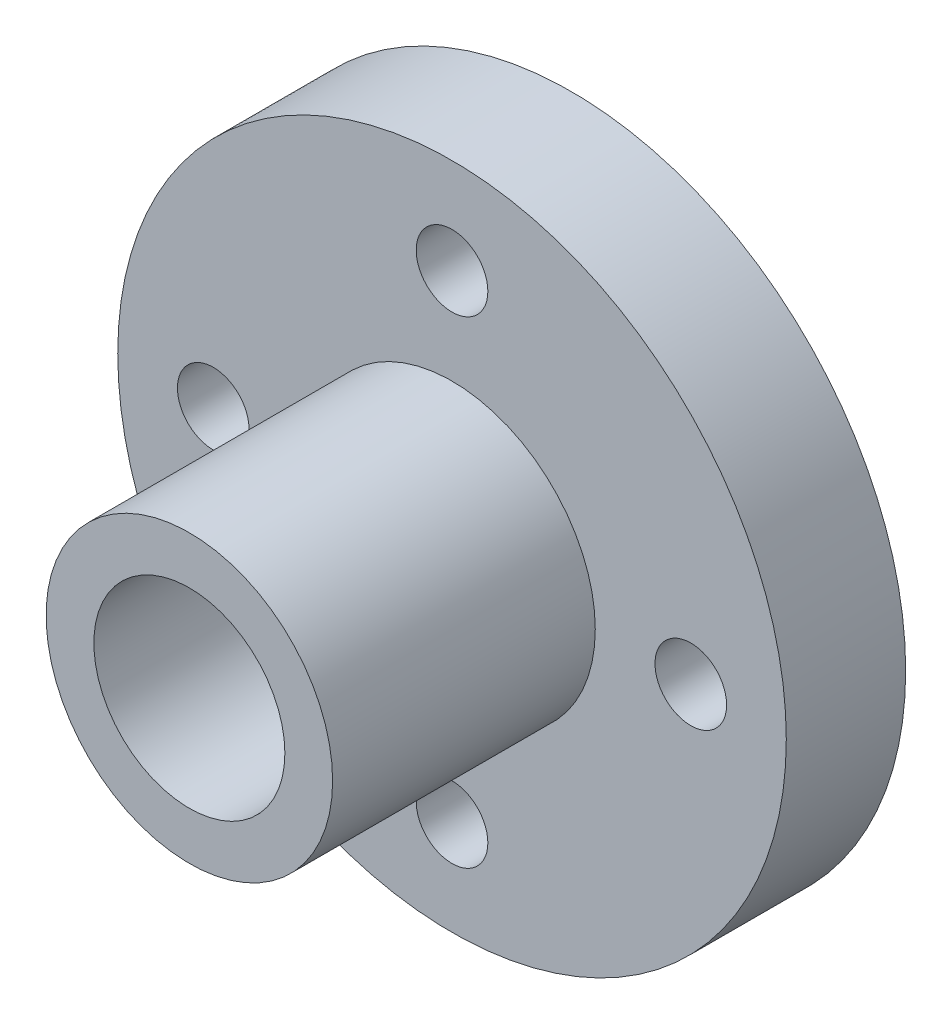
from build123d import *

# Parameters (mm, degrees)
SKETCH_1_R      = 14
SKETCH_1_R_2    = 4
SKETCH_1_R_3    = 1.5
EXTRUDE_1_DEPTH = 5
SKETCH_2_R      = 6
SKETCH_2_R_2    = 4
EXTRUDE_2_DEPTH = 11


with BuildPart() as part:
    # 草图1 → 凸台-拉伸1 (new body)
    with BuildSketch(Plane.XY):
        Circle(SKETCH_1_R)
        Circle(SKETCH_1_R_2, mode=Mode.SUBTRACT)
        with Locations((0, 10)):
            Circle(SKETCH_1_R_3, mode=Mode.SUBTRACT)
        with Locations((10, 0)):
            Circle(SKETCH_1_R_3, mode=Mode.SUBTRACT)
        with Locations((0, -10)):
            Circle(SKETCH_1_R_3, mode=Mode.SUBTRACT)
        with Locations((-10, 0)):
            Circle(SKETCH_1_R_3, mode=Mode.SUBTRACT)
    extrude(amount=EXTRUDE_1_DEPTH)

    # 草图2 → 凸台-拉伸2 (add)
    with BuildSketch(Plane.XY.offset(5)):
        Circle(SKETCH_2_R)
        Circle(SKETCH_2_R_2, mode=Mode.SUBTRACT)
    extrude(amount=EXTRUDE_2_DEPTH)


solid = part.part
